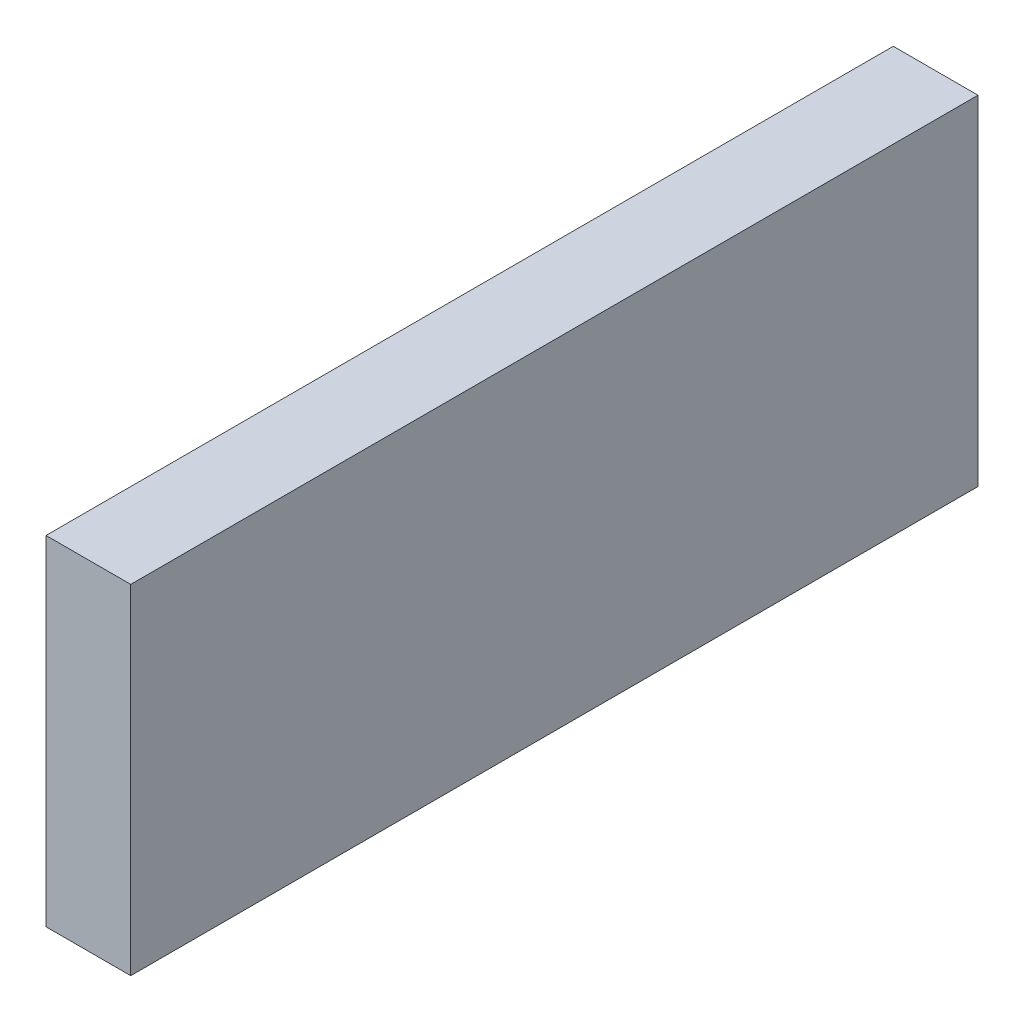
from build123d import *

# Parameters (mm, degrees)
SKETCH1_W           = 9.525
SKETCH1_H           = 95.25
BOSS_EXTRUDE1_DEPTH = 38.1


with BuildPart() as part:
    # Sketch1 → Boss-Extrude1 (new body)
    with BuildSketch(Plane(origin=(0, 0, 0), x_dir=(1, 0, 0), z_dir=(0, 1, 0))):
        with Locations((4.7625, 47.625)):
            Rectangle(SKETCH1_W, SKETCH1_H)
    extrude(amount=BOSS_EXTRUDE1_DEPTH)


solid = part.part
